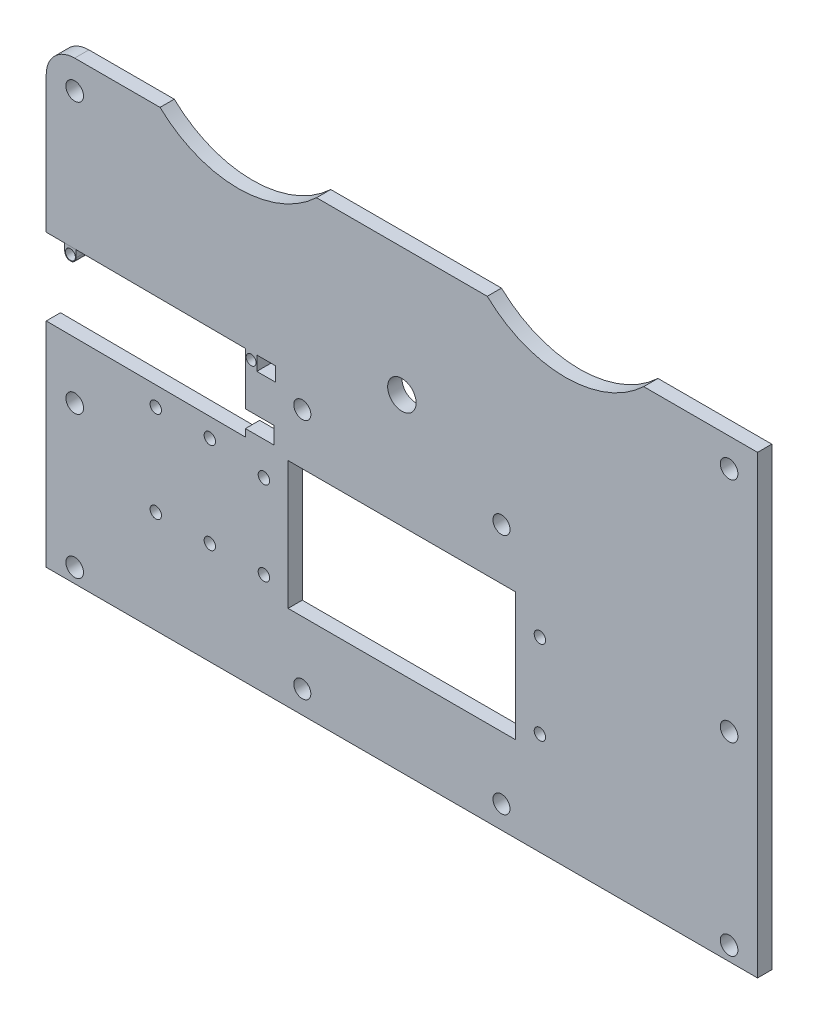
from build123d import *

# Parameters (mm, degrees)
ESQUISSE1_W              = 250
ESQUISSE1_H              = 160
BOSS_EXTRU_1_DEPTH       = 5
ENL_V_MAT_EXTRU_2_DEPTH  = 35
ESQUISSE4_R              = 3.1
ENL_V_MAT_EXTRU_3_DEPTH  = 10
ENL_V_MAT_EXTRU_4_DEPTH  = 10
ESQUISSE7_R              = 3
ENL_V_MAT_EXTRU_6_DEPTH  = 10
ESQUISSE8_R              = 3.1
ENL_V_MAT_EXTRU_7_DEPTH  = 10
ENL_V_MAT_EXTRU_10_DEPTH = 10
ESQUISSE12_R             = 1.75
BOSS_EXTRU_2_DEPTH       = 5
ESQUISSE13_W             = 10.5
ESQUISSE13_H             = 5
ENL_V_MAT_EXTRU_12_DEPTH = 5
ESQUISSE16_W             = 10
ESQUISSE16_H             = 6
ENL_V_MAT_EXTRU_14_DEPTH = 5
ENL_V_MAT_EXTRU_15_DEPTH = 10
ESQUISSE18_R             = 5
ENL_V_MAT_EXTRU_16_DEPTH = 10
ESQUISSE19_R             = 2
ENL_V_MAT_EXTRU_17_DEPTH = 29.95
ESQUISSE21_R             = 2
ESQUISSE21_R_2           = 2.001807824
ENL_V_MAT_EXTRU_18_DEPTH = 10
ESQUISSE14_W             = 4
ESQUISSE14_H             = 5
ESQUISSE14_R             = 1.75
BOSS_EXTRU_3_DEPTH       = 5


with BuildPart() as part:
    # Esquisse1 → Boss.-Extru.1 (new body)
    with BuildSketch(Plane.XY):
        with Locations((125, -80)):
            Rectangle(ESQUISSE1_W, ESQUISSE1_H)
    extrude(amount=BOSS_EXTRU_1_DEPTH)

    # Esquisse3 → Enlèv. mat.-Extru.2 (cut)
    with BuildSketch(Plane.XY.offset(5)):
        Polygon((85, -85), (125, -85), (165, -85), (165, -130), (125, -130), (85, -130), align=None)
    extrude(amount=-ENL_V_MAT_EXTRU_2_DEPTH, mode=Mode.SUBTRACT)

    # Esquisse4 → Enlèv. mat.-Extru.3 (cut)
    with BuildSketch(Plane.XY.offset(5)):
        with Locations((10, -10)):
            Circle(ESQUISSE4_R)
        with Locations((10, -155)):
            Circle(ESQUISSE4_R)
        with Locations((240, -155)):
            Circle(ESQUISSE4_R)
        with Locations((240, -10)):
            Circle(ESQUISSE4_R)
    extrude(amount=-ENL_V_MAT_EXTRU_3_DEPTH, mode=Mode.SUBTRACT)

    # Esquisse5 → Enlèv. mat.-Extru.4 (cut)
    with BuildSketch(Plane(origin=(0, 0, 0), x_dir=(-1, 0, 0), z_dir=(0, 0, -1))):
        with BuildLine():
            Line((0, 0), (-10, 0))
            ThreePointArc((-10, 0), (-2.928932188, -2.928932188), (0, -10))
            Line((0, -10), (0, 0))
        make_face()
    extrude(amount=-ENL_V_MAT_EXTRU_4_DEPTH, mode=Mode.SUBTRACT)

    # Esquisse7 → Enlèv. mat.-Extru.6 (cut)
    with BuildSketch(Plane(origin=(0, 0, 0), x_dir=(-1, 0, 0), z_dir=(0, 0, -1))):
        with Locations((-90, -152)):
            Circle(ESQUISSE7_R)
        with Locations((-90, -67)):
            Circle(ESQUISSE7_R)
        with Locations((-160, -67)):
            Circle(ESQUISSE7_R)
        with Locations((-160, -152)):
            Circle(ESQUISSE7_R)
    extrude(amount=-ENL_V_MAT_EXTRU_6_DEPTH, mode=Mode.SUBTRACT)

    # Esquisse8 → Enlèv. mat.-Extru.7 (cut)
    with BuildSketch(Plane(origin=(0, 0, 0), x_dir=(-1, 0, 0), z_dir=(0, 0, -1))):
        with Locations((-10, -105)):
            Circle(ESQUISSE8_R)
        with Locations((-240, -90)):
            Circle(ESQUISSE8_R)
    extrude(amount=-ENL_V_MAT_EXTRU_7_DEPTH, mode=Mode.SUBTRACT)

    # Esquisse11 → Enlèv. mat.-Extru.10 (cut)
    with BuildSketch(Plane(origin=(0, 0, 0), x_dir=(-1, 0, 0), z_dir=(0, 0, -1))):
        Polygon((0, -85), (-69.999061664, -85.36244471), (-69.999061664, -58.36244471), (0, -58), align=None)
    extrude(amount=-ENL_V_MAT_EXTRU_10_DEPTH, mode=Mode.SUBTRACT)

    # Esquisse13 → Enlèv. mat.-Extru.12 (cut)
    with BuildSketch(Plane.XY.offset(5)):
        with Locations((75.249061664, -60.86244471)):
            Rectangle(ESQUISSE13_W, ESQUISSE13_H)
    extrude(amount=-ENL_V_MAT_EXTRU_12_DEPTH, mode=Mode.SUBTRACT)

    # Esquisse16 → Enlèv. mat.-Extru.14 (cut)
    with BuildSketch(Plane.XY.offset(5)):
        with Locations((74.999061664, -79.76244471)):
            Rectangle(ESQUISSE16_W, ESQUISSE16_H)
    extrude(amount=-ENL_V_MAT_EXTRU_14_DEPTH, mode=Mode.SUBTRACT)

    # Esquisse17 → Enlèv. mat.-Extru.15 (cut)
    with BuildSketch(Plane.XY.offset(5)):
        with BuildLine():
            Line((210, 0), (155, 0))
            ThreePointArc((155, 0), (182.5, -10.952624903), (210, 0))
        make_face()
        with BuildLine():
            Line((95, 0), (40, 0))
            ThreePointArc((40, 0), (67.5, -10.952624903), (95, 0))
        make_face()
    extrude(amount=-ENL_V_MAT_EXTRU_15_DEPTH, mode=Mode.SUBTRACT)

    # Esquisse18 → Enlèv. mat.-Extru.16 (cut)
    with BuildSketch(Plane.XY.offset(5)):
        with Locations((125, -45)):
            Circle(ESQUISSE18_R)
    extrude(amount=-ENL_V_MAT_EXTRU_16_DEPTH, mode=Mode.SUBTRACT)

    # Esquisse19 → Enlèv. mat.-Extru.17 (cut)
    with BuildSketch(Plane.XY.offset(5)):
        with Locations((173.5, -124)):
            Circle(ESQUISSE19_R)
        with Locations((173.5, -94.5)):
            Circle(ESQUISSE19_R)
        with Locations((76.5, -94.5)):
            Circle(ESQUISSE19_R)
        with Locations((76.5, -124)):
            Circle(ESQUISSE19_R)
    extrude(amount=-ENL_V_MAT_EXTRU_17_DEPTH, mode=Mode.SUBTRACT)

    # Esquisse21 → Enlèv. mat.-Extru.18 (cut)
    with BuildSketch(Plane.XY.offset(5)):
        with Locations((38.5, -124)):
            Circle(ESQUISSE21_R)
        with Locations((57.5, -124)):
            Circle(ESQUISSE21_R_2)
        with Locations((38.5, -92)):
            Circle(ESQUISSE21_R)
        with Locations((57.5, -92)):
            Circle(ESQUISSE21_R)
    extrude(amount=-ENL_V_MAT_EXTRU_18_DEPTH, mode=Mode.SUBTRACT)

    # Esquisse14 → Boss.-Extru.3 (add)
    with BuildSketch(Plane.XY.offset(5)):
        with Locations((72, -60.86244471)):
            Rectangle(ESQUISSE14_W, ESQUISSE14_H)
        with Locations((72, -60.86244471)):
            Circle(ESQUISSE14_R, mode=Mode.SUBTRACT)
    extrude(amount=-BOSS_EXTRU_3_DEPTH)


with BuildPart() as body_2:
    # Esquisse12 → Boss.-Extru.2 (new body)
    with BuildSketch(Plane(origin=(0, 0, 0), x_dir=(-1, 0, 0), z_dir=(0, 0, -1))):
        with BuildLine():
            ThreePointArc((-10.5, -60.554367435), (-8.489697779, -62.533682841), (-6.5, -60.533656031))
            Line((-6.5, -60.533656031), (-6.5, -58.033656031))
            Line((-6.5, -58.033656031), (-10.5, -58.054367435))
            Line((-10.5, -58.054367435), (-10.5, -60.554367435))
        make_face()
        with Locations((-8.50005362, -60.533656031)):
            Circle(ESQUISSE12_R, mode=Mode.SUBTRACT)
    extrude(amount=-BOSS_EXTRU_2_DEPTH)


solid = Compound([part.part, body_2.part])
